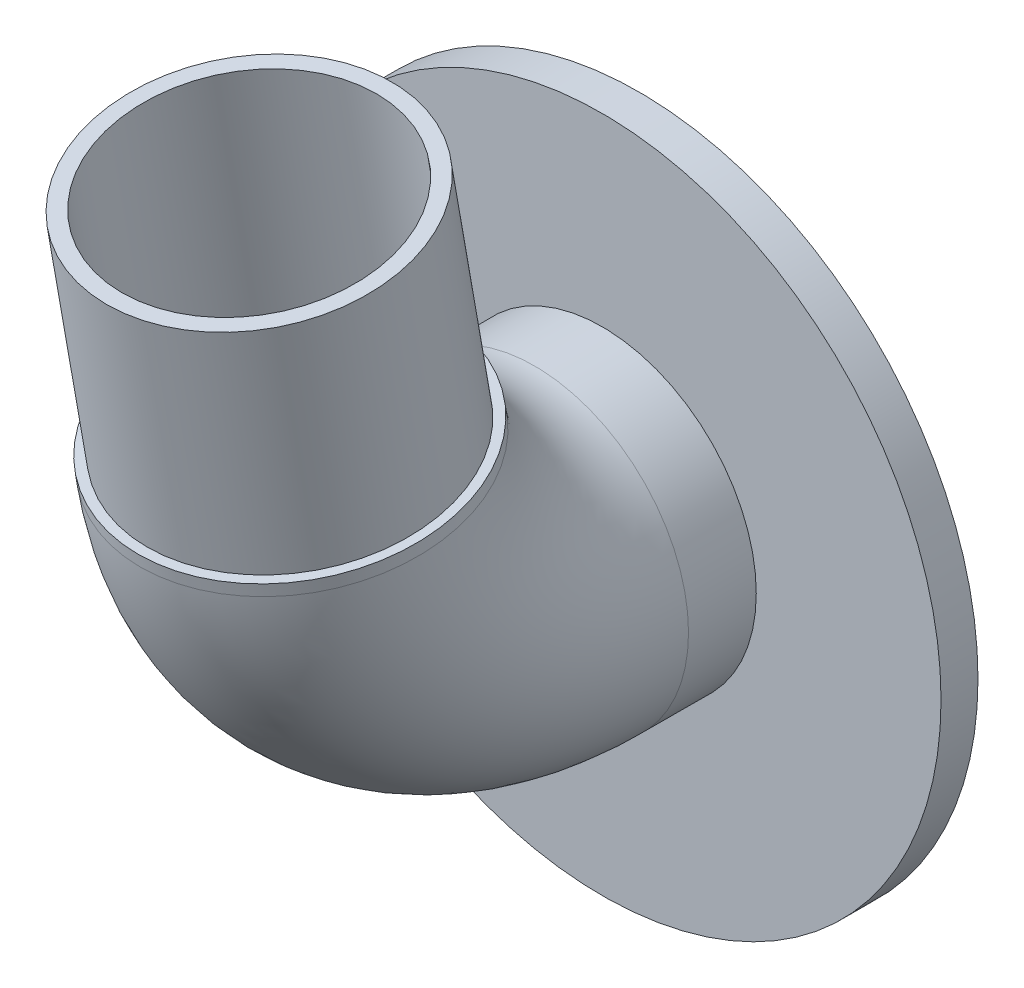
from build123d import *

# Parameters (mm, degrees)
ESQUISSE1_R             = 55
ESQUISSE1_R_2           = 25
BOSS_EXTRU_1_DEPTH      = 6
BOSS_EXTRU_2_DEPTH      = 1
BOSS_EXTRU_2_DEPTH_BACK = 6
ESQUISSE2_R             = 25
ESQUISSE2_R_2           = 21
ESQUISSE4_R             = 25
ESQUISSE4_R_2           = 21
ESQUISSE8_R             = 25
ESQUISSE8_R_2           = 23.5
ENL_V_MAT_EXTRU_1_DEPTH = 38


with BuildPart() as part:
    # Esquisse1 → Boss.-Extru.1 (new body)
    with BuildSketch(Plane.XY):
        Circle(ESQUISSE1_R)
        Circle(ESQUISSE1_R_2, mode=Mode.SUBTRACT)
    extrude(amount=BOSS_EXTRU_1_DEPTH)

    # Esquisse2 → Boss.-Extru.2 (add, two sides: drawn at the far end of the back side and taken through both)
    with BuildSketch(Plane.XY.offset(6).offset(-BOSS_EXTRU_2_DEPTH_BACK)):
        Circle(ESQUISSE2_R)
        Circle(ESQUISSE2_R_2, mode=Mode.SUBTRACT)
    extrude(amount=BOSS_EXTRU_2_DEPTH + BOSS_EXTRU_2_DEPTH_BACK)

    # Balayage5: sweep along a path in Esquisse3
    with BuildLine(Plane(origin=(0, 0, 0), x_dir=(0, 0, -1), z_dir=(1, 0, 0))) as balayage5_path:
        Line((-7, 0), (-17, 0))
        ThreePointArc((-17, 0), (-42.711504387, 9.358222275), (-56.39231012, 33.054072893))
        Line((-56.39231012, 33.054072893), (-63.338237227, 72.446383014))
    # Esquisse4 → Balayage5 (sweep)
    with BuildSketch(Plane.XY.offset(7)):
        Circle(ESQUISSE4_R)
        Circle(ESQUISSE4_R_2, mode=Mode.SUBTRACT)
    sweep(path=balayage5_path.line)

    # Esquisse8 → Enlèv. mat.-Extru.1 (cut)
    with BuildSketch(Plane(origin=(0, 81.093333754, 14.298942697), x_dir=(1, 0, 0), z_dir=(0, 0.9848077530122087, 0.17364817766692714))):
        with Locations(Location((0, -49.795804695, 0), (0, 0, 270))):
            Circle(ESQUISSE8_R)
        with Locations(Location((0, -49.795804695, 0), (0, 0, 270))):
            Circle(ESQUISSE8_R_2, mode=Mode.SUBTRACT)
    extrude(amount=-ENL_V_MAT_EXTRU_1_DEPTH, mode=Mode.SUBTRACT)


solid = part.part
